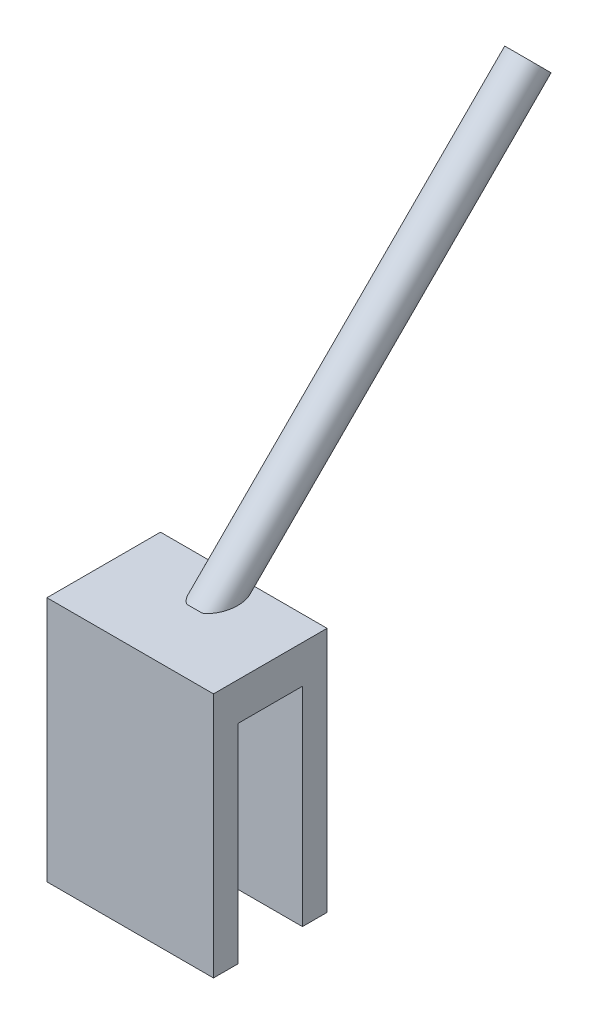
from build123d import *

# Parameters (mm, degrees)
SKETCH1_W               = 44
SKETCH1_H               = 30
BOSS_EXTRUDE1_DEPTH     = 65
CUT_EXTRUDE1_DEPTH      = 80.912452096
CUT_EXTRUDE1_DEPTH_BACK = 80.912452096
SKETCH2_W               = 17
SKETCH2_H               = 55
SKETCH3_R               = 5
BOSS_EXTRUDE2_DEPTH     = 120
SKETCH3_2_R             = 5
BOSS_EXTRUDE3_DEPTH     = 120


with BuildPart() as part:
    # Sketch1 → Boss-Extrude1 (new body)
    with BuildSketch(Plane(origin=(0, 0, 0), x_dir=(1, 0, 0), z_dir=(0, 1, 0))):
        Rectangle(SKETCH1_W, SKETCH1_H)
    extrude(amount=BOSS_EXTRUDE1_DEPTH)

    # Sketch2 → Cut-Extrude1 (cut, two sides: drawn at the far end of the back side and taken through both)
    with BuildSketch(Plane(origin=(22, 0, 0), x_dir=(0, 0, -1), z_dir=(1, 0, 0)).offset(-CUT_EXTRUDE1_DEPTH_BACK)):
        with Locations((0, 27.5)):
            Rectangle(SKETCH2_W, SKETCH2_H)
    extrude(amount=CUT_EXTRUDE1_DEPTH + CUT_EXTRUDE1_DEPTH_BACK, mode=Mode.SUBTRACT)

    # Sketch3 → Boss-Extrude2 (add)
    with BuildSketch(Plane(origin=(0, 33.487457391, -33.487457391), x_dir=(8.429181601007666e-15, -0.7071067811865441, -0.707106781186551), z_dir=(-8.648297214624002e-15, 0.707106781186551, -0.7071067811865441))):
        with Locations((-40, 0)):
            Circle(SKETCH3_R)
    extrude(amount=BOSS_EXTRUDE2_DEPTH)

    # Sketch3<2> → Boss-Extrude3 (add)
    with BuildSketch(Plane(origin=(0, 33.487457391, -33.487457391), x_dir=(8.429181601007666e-15, -0.7071067811865441, -0.707106781186551), z_dir=(-8.648297214624002e-15, 0.707106781186551, -0.7071067811865441))):
        with Locations((-40, 0)):
            Circle(SKETCH3_2_R)
    extrude(amount=BOSS_EXTRUDE3_DEPTH)


solid = part.part
